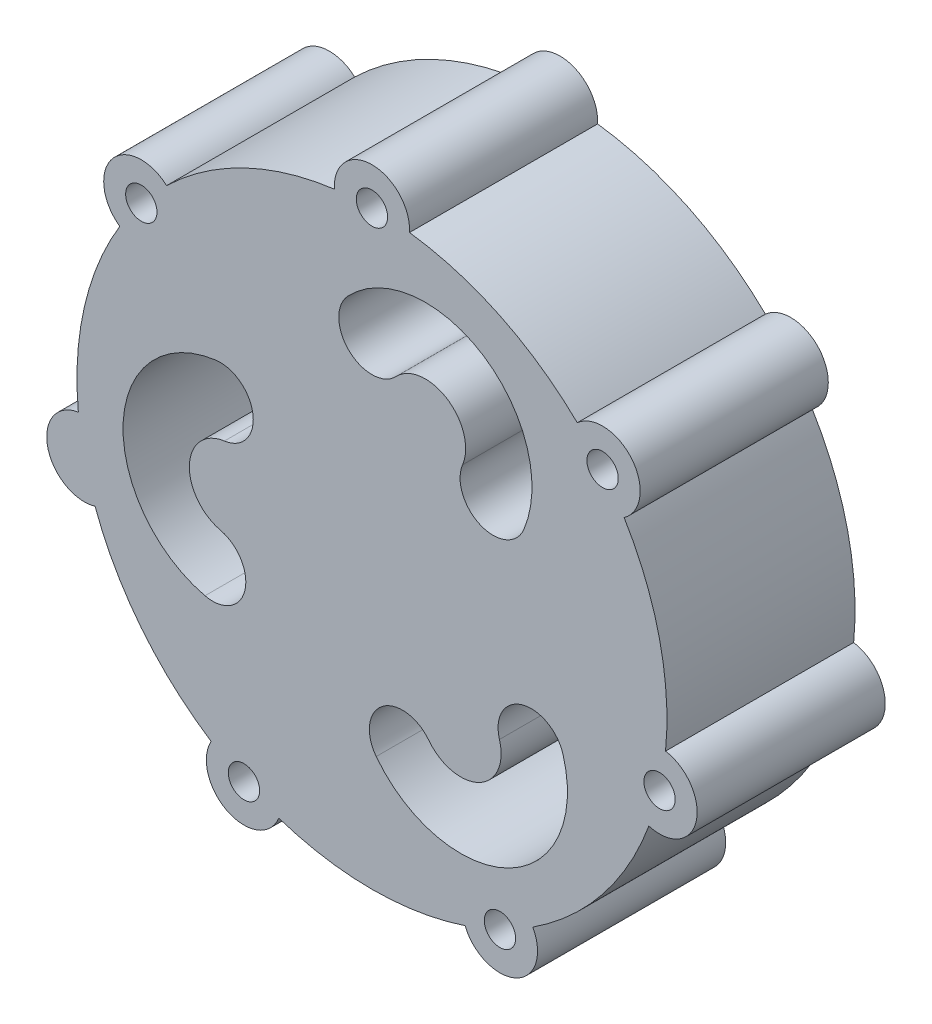
from build123d import *

# Parameters (mm, degrees)
SKETCH1_R           = 2.5
BOSS_EXTRUDE1_DEPTH = 30


with BuildPart() as part:
    # Sketch1 → Boss-Extrude1 (new body)
    with BuildSketch(Plane.XY):
        with BuildLine():
            ThreePointArc((5.987788455, 46.66284585), (0, 53.045454545), (-5.987788455, 46.66284585))
            ThreePointArc((-5.987788455, 46.66284585), (-20.412257727, 42.386489922), (-32.749156909, 33.775250038))
            ThreePointArc((-32.749156909, 33.775250038), (-41.472606365, 33.073299944), (-40.215806985, 24.412366988))
            ThreePointArc((-40.215806985, 24.412366988), (-45.865926778, 10.468598484), (-46.82531916, -4.545797942))
            ThreePointArc((-46.82531916, -4.545797942), (-51.715494251, -11.803724088), (-44.160502601, -16.221122137))
            ThreePointArc((-44.160502601, -16.221122137), (-36.781617471, -29.332361133), (-25.641061021, -39.443767354))
            ThreePointArc((-25.641061021, -39.443767354), (-23.015560161, -47.792303129), (-14.851439049, -44.639775442))
            ThreePointArc((-14.851439049, -44.639775442), (0, -47.045454545), (14.851439049, -44.639775442))
            ThreePointArc((14.851439049, -44.639775442), (23.015560161, -47.792303129), (25.641061021, -39.443767354))
            ThreePointArc((25.641061021, -39.443767354), (36.781617471, -29.332361133), (44.160502601, -16.221122137))
            ThreePointArc((44.160502601, -16.221122137), (51.715494251, -11.803724088), (46.82531916, -4.545797942))
            ThreePointArc((46.82531916, -4.545797942), (45.865926778, 10.468598484), (40.215806985, 24.412366988))
            ThreePointArc((40.215806985, 24.412366988), (41.472606365, 33.073299944), (32.749156909, 33.775250038))
            ThreePointArc((32.749156909, 33.775250038), (20.412257727, 42.386489922), (5.987788455, 46.66284585))
        make_face()
        with Locations((0, 47.045454545)):
            Circle(SKETCH1_R, mode=Mode.SUBTRACT)
        with Locations((36.781617471, 29.332361133)):
            Circle(SKETCH1_R, mode=Mode.SUBTRACT)
        with Locations((45.865926778, -10.468598484)):
            Circle(SKETCH1_R, mode=Mode.SUBTRACT)
        with Locations((20.412257727, -42.386489922)):
            Circle(SKETCH1_R, mode=Mode.SUBTRACT)
        with Locations((-20.412257727, -42.386489922)):
            Circle(SKETCH1_R, mode=Mode.SUBTRACT)
        with Locations((-36.781617471, 29.332361133)):
            Circle(SKETCH1_R, mode=Mode.SUBTRACT)
        with BuildLine():
            ThreePointArc((0.677628824, -28.364607267), (21.907582959, -33.164561623), (30.469177048, -13.153324254))
            ThreePointArc((30.469177048, -13.153324254), (23.889713582, -9.599573413), (20.33596274, -16.179036879))
            ThreePointArc((20.33596274, -16.179036879), (17.098534821, -23.745961668), (9.070772057, -21.930936793))
            ThreePointArc((9.070772057, -21.930936793), (1.657365204, -20.951200413), (0.677628824, -28.364607267))
        make_face(mode=Mode.SUBTRACT)
        with BuildLine():
            ThreePointArc((24.225656049, 14.769147409), (17.767561392, 35.554804189), (-3.843475576, 32.963743483))
            ThreePointArc((-3.843475576, 32.963743483), (-3.63138235, 25.488885557), (3.843475576, 25.700978783))
            ThreePointArc((3.843475576, 25.700978783), (12.015338631, 26.680746357), (14.457362363, 18.82098743))
            ThreePointArc((14.457362363, 18.82098743), (17.315589196, 11.910920576), (24.225656049, 14.769147409))
        make_face(mode=Mode.SUBTRACT)
        with BuildLine():
            ThreePointArc((-24.903284873, 13.595459858), (-39.67514435, -2.390242566), (-26.625701472, -19.810419229))
            ThreePointArc((-26.625701472, -19.810419229), (-20.258331232, -15.889312144), (-24.179438316, -9.521941904))
            ThreePointArc((-24.179438316, -9.521941904), (-29.113873453, -2.934784689), (-23.52813442, 3.109949364))
            ThreePointArc((-23.52813442, 3.109949364), (-18.9729544, 9.040279837), (-24.903284873, 13.595459858))
        make_face(mode=Mode.SUBTRACT)
    extrude(amount=BOSS_EXTRUDE1_DEPTH)


solid = part.part
